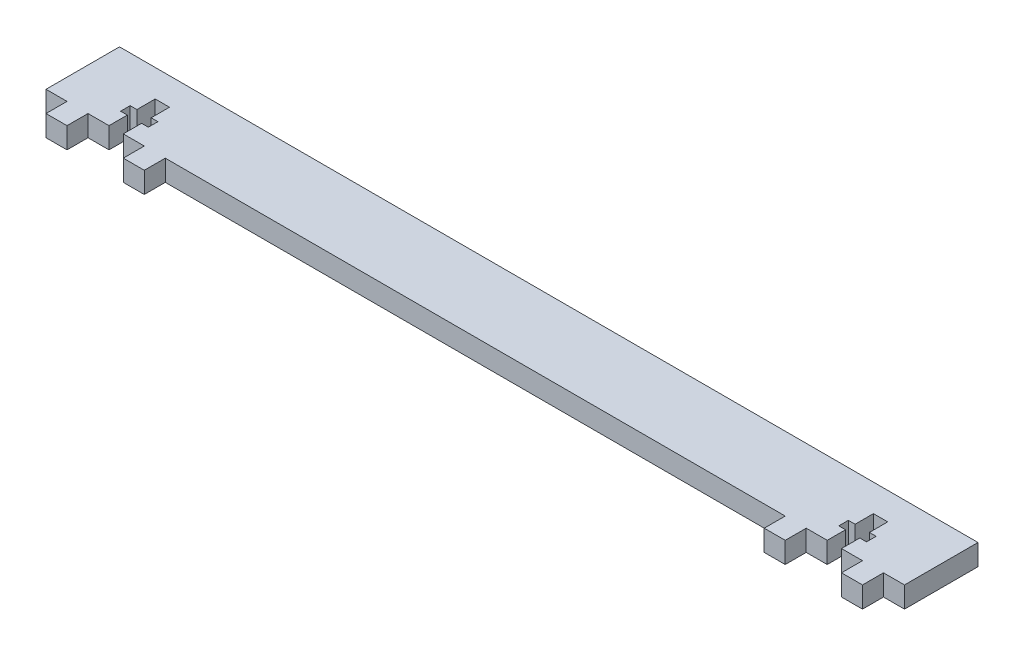
from build123d import *

# Parameters (mm, degrees)
BOSS_EXTRUDE1_DEPTH = 6.35


with BuildPart() as part:
    # Sketch1 → Boss-Extrude1 (new body)
    with BuildSketch(Plane(origin=(0, 0, 0), x_dir=(1, 0, 0), z_dir=(0, 1, 0))):
        Polygon((100.076, -11.1125), (100.076, -17.4625), (93.726, -17.4625), (93.726, -11.1125), (-93.726, -11.1125), (-93.726, -17.4625), (-100.076, -17.4625), (-100.076, -11.1125), (-106.426, -11.1125), (-106.426, -5.577500021), (-104.385000018, -5.577500021), (-104.385000018, -2.677499979), (-106.426, -2.677499979), (-106.426, 2.8575), (-110.744, 2.8575), (-110.744, -2.677499979), (-112.784999982, -2.677499979), (-112.784999982, -5.577500021), (-110.744, -5.577500021), (-110.744, -11.1125), (-117.094, -11.1125), (-117.094, -17.4625), (-123.444, -17.4625), (-123.444, -11.1125), (-129.794, -11.1125), (-129.794, 11.1125), (129.794, 11.1125), (129.794, -11.1125), (123.444, -11.1125), (123.444, -17.4625), (117.094, -17.4625), (117.094, -11.1125), (110.744, -11.1125), (110.744, -5.577500021), (112.784999982, -5.577500021), (112.784999982, -2.677499979), (110.744, -2.677499979), (110.744, 2.8575), (106.426, 2.8575), (106.426, -2.677499979), (104.385000018, -2.677499979), (104.385000018, -5.577500021), (106.426, -5.577500021), (106.426, -11.1125), align=None)
    extrude(amount=BOSS_EXTRUDE1_DEPTH)


solid = part.part
